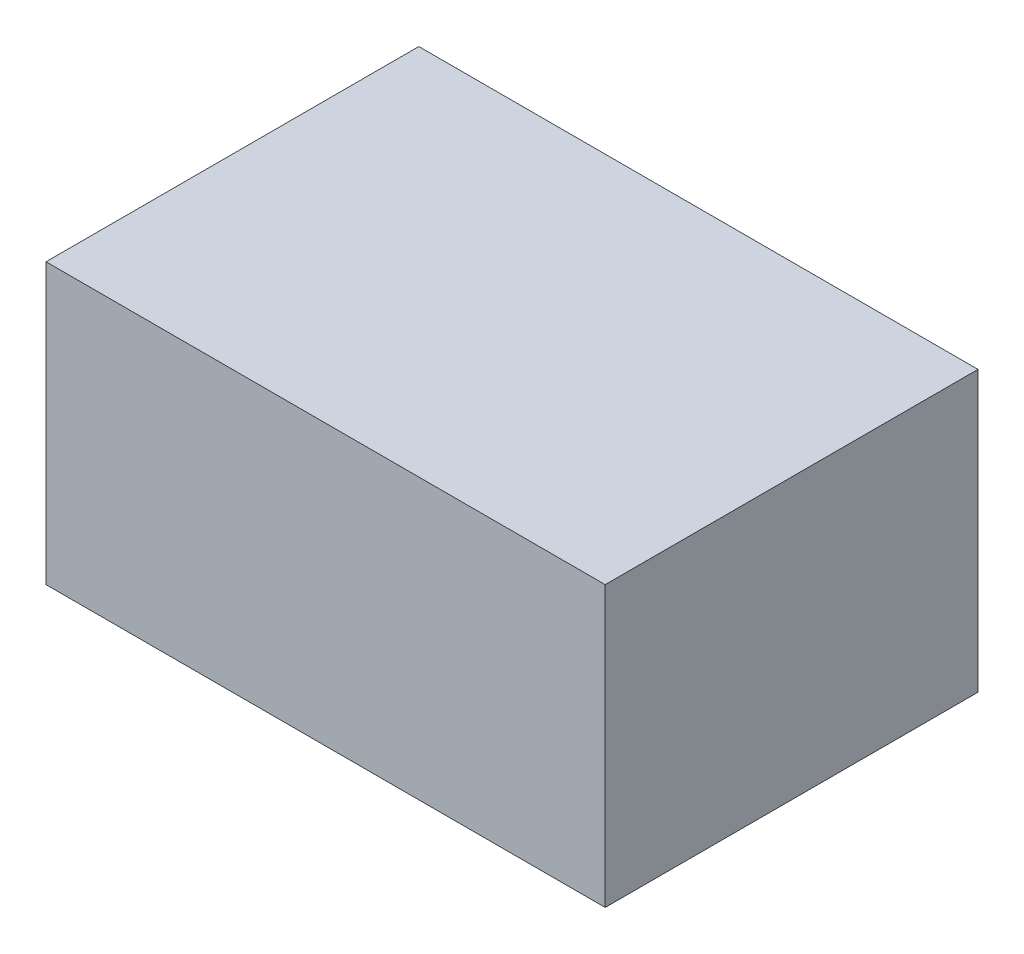
from build123d import *

# Parameters (mm, degrees)
SKETCH_1_W      = 120
SKETCH_1_H      = 80
EXTRUDE_1_DEPTH = 60
SHELL_1_T       = -5


with BuildPart() as part:
    # Эскиз1 → Бобышка-Вытянуть1 (new body)
    with BuildSketch(Plane(origin=(0, 0, 0), x_dir=(1, 0, 0), z_dir=(0, 1, 0))):
        with Locations((60, 40)):
            Rectangle(SKETCH_1_W, SKETCH_1_H)
    extrude(amount=EXTRUDE_1_DEPTH)

    # Оболочка1
    shell_1_openings = [part.faces().sort_by_distance(p)[0] for p in [
        (60, 0, -40),
    ]]
    offset(amount=SHELL_1_T, openings=shell_1_openings, kind=Kind.INTERSECTION)


solid = part.part
